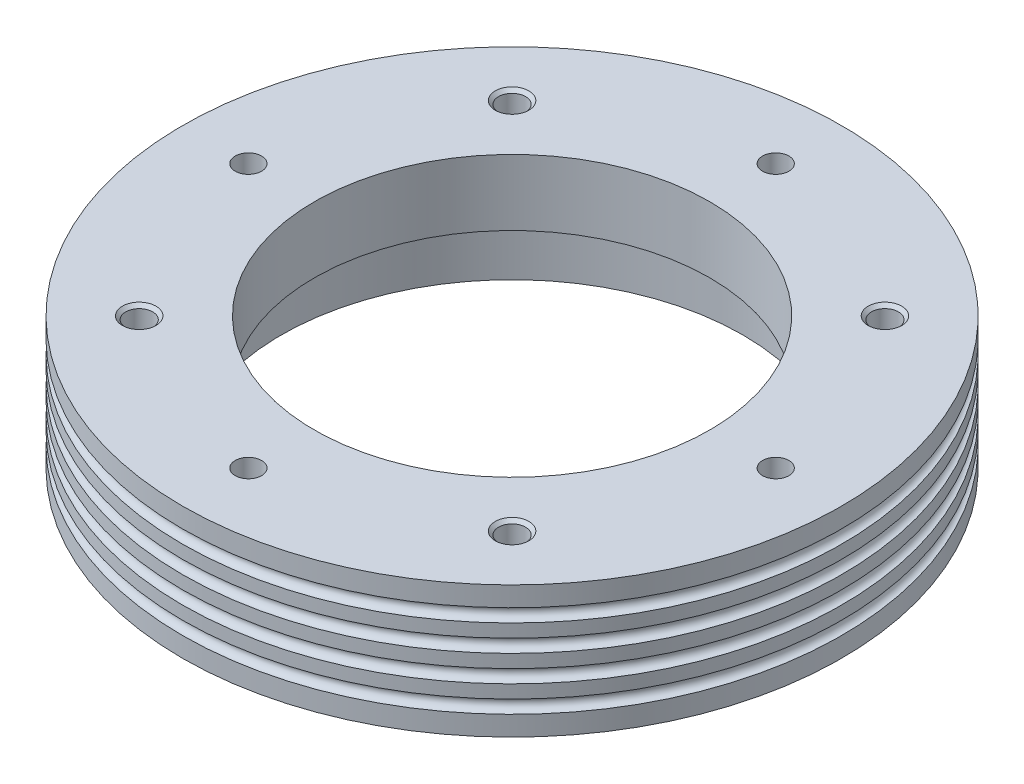
from build123d import *

# Parameters (mm, degrees)
SKETCH_1_R                     = 25
EXTRUDE_1_DEPTH                = 10
HOLE_WIZARD_1_D                = 2
SKETCH_4_R                     = 17.5
CUT_EXTRUDE_1_DEPTH            = 5
SKETCH_5_R                     = 15
CUT_EXTRUDE_2_DEPTH            = 5
HOLE_WIZARD_M2_5_1_D           = 2.05
HOLE_WIZARD_M2_5_1_CSINK_D     = 2.55
HOLE_WIZARD_M2_5_1_CSINK_ANGLE = 90
SWEEP_1_PROFILE_R              = 0.5
PATTERN_LINEAR_1_COUNT         = 4
PATTERN_LINEAR_1_PITCH         = 2


with BuildPart() as part:
    # 草图1 → 凸台-拉伸1 (new body)
    with BuildSketch(Plane(origin=(0, 0, 0), x_dir=(1, 0, 0), z_dir=(0, 1, 0))):
        with Locations(Location((0, 0, 0), (0, 0, 270))):
            Circle(SKETCH_1_R)
    extrude(amount=EXTRUDE_1_DEPTH)

    # 孔1 (through all)
    with Locations(Plane(origin=(0, 10, 0), x_dir=(1, 0, 0), z_dir=(0, 1, 0))):
        with Locations((0, -20), (20, 0), (0, 20), (-20, 0)):
            Hole(HOLE_WIZARD_1_D / 2)

    # 草图4 → 切除-拉伸1 (cut)
    with BuildSketch(Plane.XZ):
        with Locations(Location((0, 0, 0), (0, 0, 270))):
            Circle(SKETCH_4_R)
    extrude(amount=-CUT_EXTRUDE_1_DEPTH, mode=Mode.SUBTRACT)

    # 草图5 → 切除-拉伸2 (cut)
    with BuildSketch(Plane.XZ.offset(-5)):
        with Locations(Location((0, 0, 0), (0, 0, 270))):
            Circle(SKETCH_5_R)
    extrude(amount=-CUT_EXTRUDE_2_DEPTH, mode=Mode.SUBTRACT)

    # M2.5 螺纹孔1 (through all)
    with Locations(Plane(origin=(0, 10, 0), x_dir=(1, 0, 0), z_dir=(0, 1, 0))):
        with Locations((-14.142135624, 14.142135624), (14.142135624, 14.142135624), (14.142135624, -14.142135624), (-14.142135624, -14.142135624)):
            CounterSinkHole(HOLE_WIZARD_M2_5_1_D / 2, HOLE_WIZARD_M2_5_1_CSINK_D / 2, counter_sink_angle=HOLE_WIZARD_M2_5_1_CSINK_ANGLE)

    # 切除-扫描1: sweep along a path in 草图11
    with BuildLine(Plane(origin=(0, 2, 0), x_dir=(1, 0, 0), z_dir=(0, 1, 0))) as sweep_1_path:
        CenterArc((0, 0), 25, 0, 360)
    # 切除-扫描1 profile (on start of the path) → 切除-扫描1 (sweep, cut)
    with BuildSketch(Plane(origin=(25, 2, 0), x_dir=(-1, 0, 0), z_dir=(0, 0, -1))):
        Circle(SWEEP_1_PROFILE_R)
    sweep_1 = sweep(path=sweep_1_path.line, mode=Mode.SUBTRACT)

    # 阵列(线性)1: 切除-扫描1 ×4
    with Locations(*[(0, i * PATTERN_LINEAR_1_PITCH, 0) for i in range(1, PATTERN_LINEAR_1_COUNT)]):
        add(sweep_1, mode=Mode.SUBTRACT)


solid = part.part
